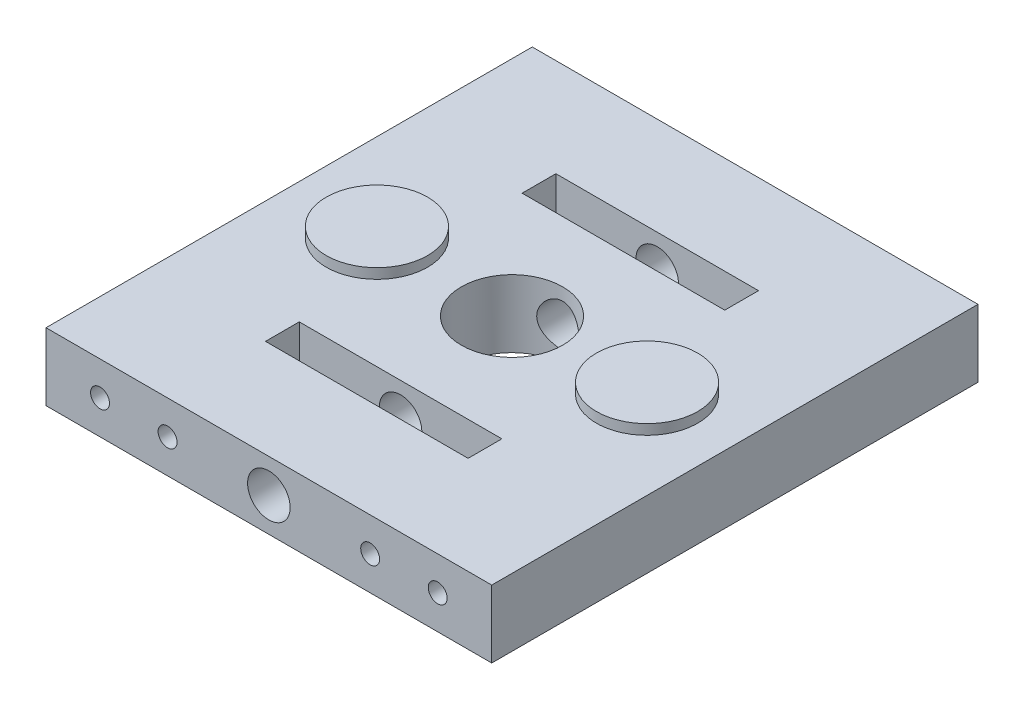
from build123d import *

# Parameters (mm, degrees)
SKETCH1_W               = 66
SKETCH1_H               = 72
BOSS_EXTRUDE1_DEPTH     = 10
SKETCH2_R               = 1.4
CUT_EXTRUDE1_DEPTH      = 10
CUT_EXTRUDE2_DEPTH      = 50.849774322
CUT_EXTRUDE2_DEPTH_BACK = 50.849774322
SKETCH3_W               = 30
SKETCH3_H               = 5
CUT_EXTRUDE3_DEPTH      = 80.831071645
CUT_EXTRUDE3_DEPTH_BACK = 80.831071645
SKETCH4_R               = 3.15
SKETCH5_R               = 7.5
BOSS_EXTRUDE2_DEPTH     = 1.5
CUT_EXTRUDE4_DEPTH      = 50.849774322
CUT_EXTRUDE4_DEPTH_BACK = 50.849774322
SKETCH6_R               = 7.5


with BuildPart() as part:
    # Sketch1 → Boss-Extrude1 (new body)
    with BuildSketch(Plane(origin=(0, 0, 0), x_dir=(1, 0, 0), z_dir=(0, 1, 0))):
        Rectangle(SKETCH1_W, SKETCH1_H)
    extrude(amount=BOSS_EXTRUDE1_DEPTH)

    # Sketch2 → Cut-Extrude1 (cut)
    with BuildSketch(Plane.XY.offset(36)):
        with Locations((-15, 5)):
            Circle(SKETCH2_R)
        with Locations((15, 5)):
            Circle(SKETCH2_R)
        with Locations((-25, 5)):
            Circle(SKETCH2_R)
        with Locations((25, 5)):
            Circle(SKETCH2_R)
    cut_extrude1 = extrude(amount=-CUT_EXTRUDE1_DEPTH, mode=Mode.SUBTRACT)

    # Mirror1: Cut-Extrude1 across plane
    add(cut_extrude1.mirror(Plane.XY), mode=Mode.SUBTRACT)

    # Sketch3 → Cut-Extrude2 (cut, two sides: drawn at the far end of the back side and taken through both)
    with BuildSketch(Plane(origin=(0, 10, 0), x_dir=(1, 0, 0), z_dir=(0, 1, 0)).offset(-CUT_EXTRUDE2_DEPTH_BACK)):
        with Locations((0, -19)):
            Rectangle(SKETCH3_W, SKETCH3_H)
        with Locations((0, 19)):
            Rectangle(SKETCH3_W, SKETCH3_H)
    extrude(amount=CUT_EXTRUDE2_DEPTH + CUT_EXTRUDE2_DEPTH_BACK, mode=Mode.SUBTRACT)

    # Sketch4 → Cut-Extrude3 (cut, two sides: drawn at the far end of the back side and taken through both)
    with BuildSketch(Plane.XY.offset(36).offset(-CUT_EXTRUDE3_DEPTH_BACK)):
        with Locations((0, 5)):
            Circle(SKETCH4_R)
    extrude(amount=CUT_EXTRUDE3_DEPTH + CUT_EXTRUDE3_DEPTH_BACK, mode=Mode.SUBTRACT)

    # Sketch5 → Boss-Extrude2 (add)
    with BuildSketch(Plane(origin=(0, 10, 0), x_dir=(1, 0, 0), z_dir=(0, 1, 0))):
        with Locations(Location((-20, 0, 0), (0, 0, 90))):
            Circle(SKETCH5_R)
        with Locations(Location((20, 0, 0), (0, 0, 90))):
            Circle(SKETCH5_R)
    extrude(amount=BOSS_EXTRUDE2_DEPTH)

    # Sketch6 → Cut-Extrude4 (cut, two sides: drawn at the far end of the back side and taken through both)
    with BuildSketch(Plane(origin=(0, 10, 0), x_dir=(1, 0, 0), z_dir=(0, 1, 0)).offset(-CUT_EXTRUDE4_DEPTH_BACK)):
        with Locations(Location((0, 0, 0), (0, 0, 270))):
            Circle(SKETCH6_R)
    extrude(amount=CUT_EXTRUDE4_DEPTH + CUT_EXTRUDE4_DEPTH_BACK, mode=Mode.SUBTRACT)


solid = part.part
